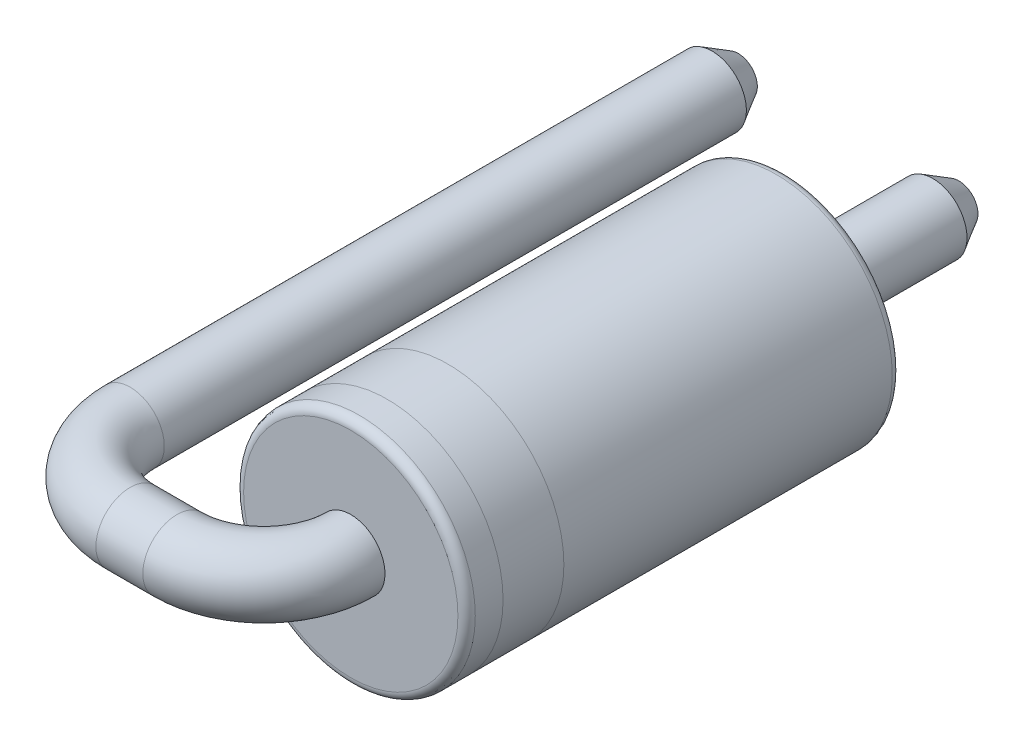
from build123d import *
from OCP.BRepFilletAPI import BRepFilletAPI_MakeChamfer

# Parameters (mm, degrees)
SKETCH1_R      = 0.3937
CHAMFER1_SIZE  = 0.3
CHAMFER1_SIZE2 = 0.173205081
SKETCH4_R      = 1.3335
EXTRUDE2_DEPTH = 5
FILLET2_R      = 0.1


with BuildPart() as part:
    # Sweep1: sweep along a path in Sketch3
    with BuildLine(Plane(origin=(0, 0, 0), x_dir=(1, 0, 0), z_dir=(0, 1, 0))) as sweep1_path:
        Line((1.27, 0), (1.27, -7))
        ThreePointArc((1.27, -7), (0.977106781, -7.707106781), (0.27, -8))
        Line((0.27, -8), (-0.27, -8))
        ThreePointArc((-0.27, -8), (-0.977106781, -7.707106781), (-1.27, -7))
        Line((-1.27, -7), (-1.27, 0))
    # Sketch1 → Sweep1 (sweep)
    with BuildSketch(Plane.XY):
        with Locations((1.27, 0)):
            Circle(SKETCH1_R)
    sweep(path=sweep1_path.line)

    # Chamfer1: one chamfer whose edges measure the first distance from different faces: ONE call of the kernel's chamfer builder (chamfer() names one face for all edges)
    chamfer1_edges_1 = [part.edges().sort_by_distance(p)[0] for p in [
        (0.8763, 0, 0),
    ]]
    chamfer1_side_1 = [part.faces().sort_by_distance(p)[0] for p in [
        (0.8763, 0, 3.5),
    ]]
    chamfer1_edges_2 = [part.edges().sort_by_distance(p)[0] for p in [
        (-0.8763, 0, 0),
    ]]
    chamfer1_side_2 = [part.faces().sort_by_distance(p)[0] for p in [
        (-0.8763, 0, 3.5),
    ]]
    chamfer1 = BRepFilletAPI_MakeChamfer(part.part.solid().wrapped)
    for e in chamfer1_edges_1:
        chamfer1.Add(CHAMFER1_SIZE, CHAMFER1_SIZE2, e.wrapped, chamfer1_side_1[0].wrapped)  # the first distance lies on this face
    for e in chamfer1_edges_2:
        chamfer1.Add(CHAMFER1_SIZE, CHAMFER1_SIZE2, e.wrapped, chamfer1_side_2[0].wrapped)  # the first distance lies on this face
    add(Compound.cast(chamfer1.Shape()), mode=Mode.REPLACE)

    # Sketch4 → Extrude2 (add)
    with BuildSketch(Plane.XY.offset(2)):
        with Locations((1.27, 0)):
            Circle(SKETCH4_R)
    extrude(amount=EXTRUDE2_DEPTH)

    # Fillet2
    fillet2_edges = [part.edges().sort_by_distance(p)[0] for p in [
        (-0.0635, 0, 7),
        (-0.0635, 0, 2),
    ]]
    fillet(fillet2_edges, radius=FILLET2_R)


solid = part.part
